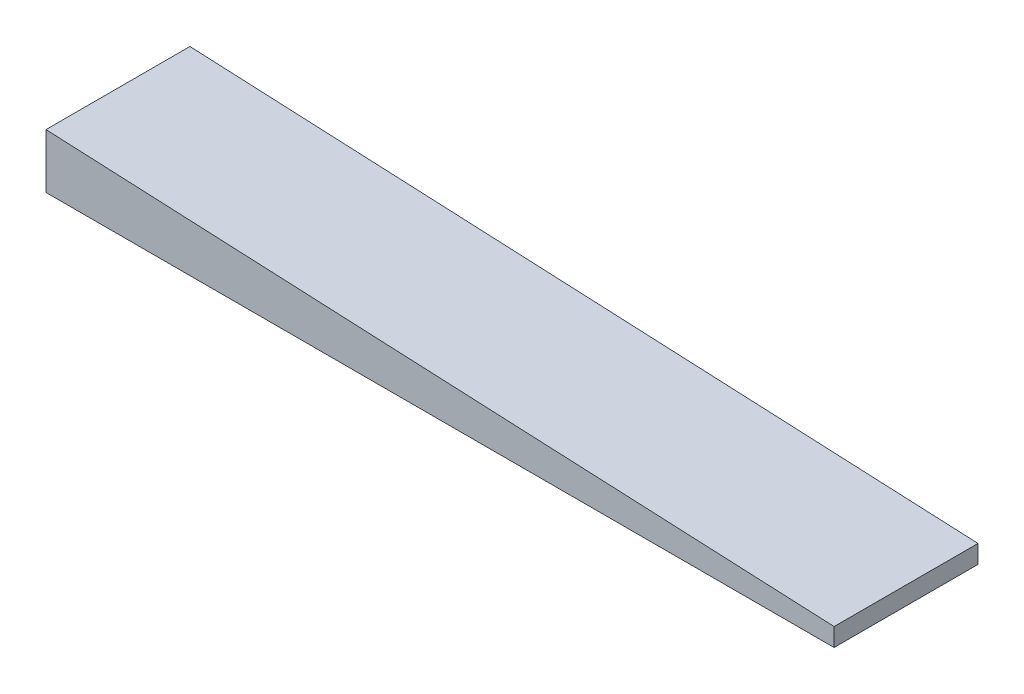
from build123d import *

# Parameters (mm, degrees)
BOSS_EXTRUDE1_DEPTH = 38.1


with BuildPart() as part:
    # Sketch1 → Boss-Extrude1 (new body)
    with BuildSketch(Plane.XY):
        Polygon((208.638979216, 14.430304667), (208.638979216, 0), (417.277958838, 0), (417.277958838, 4.810101552), align=None)
    extrude(amount=BOSS_EXTRUDE1_DEPTH)


solid = part.part
